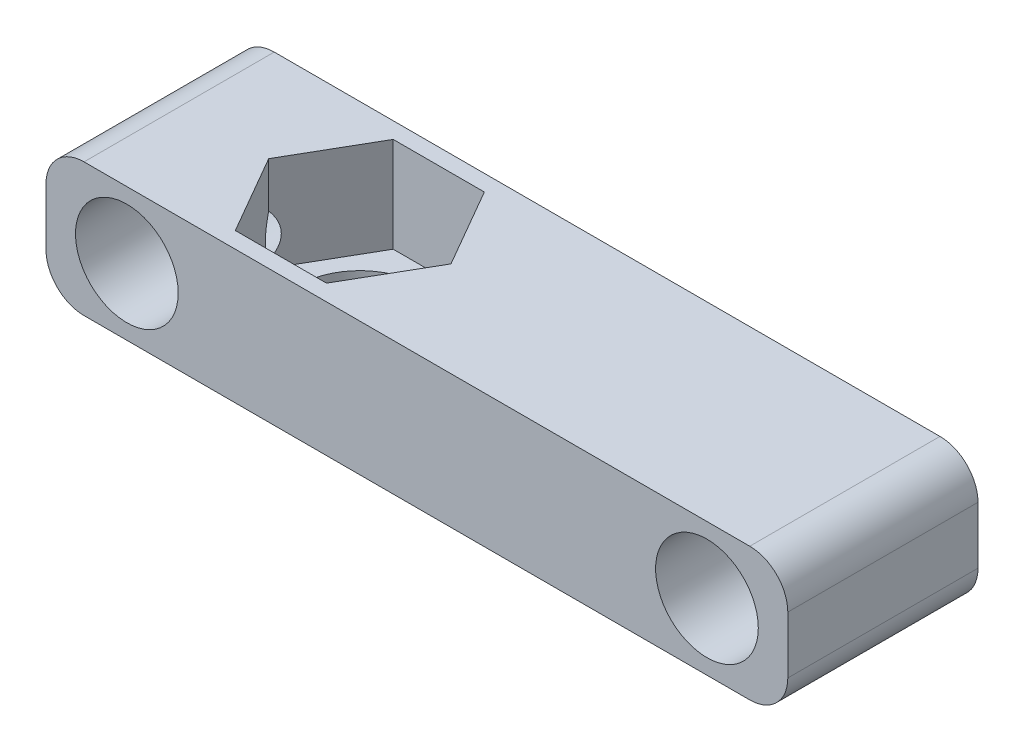
from build123d import *

# Parameters (mm, degrees)
CROQUIS1_W              = 39
CROQUIS1_H              = 7
CROQUIS1_R              = 2.7
SALIENTE_EXTRUIR1_DEPTH = 10
CORTAR_EXTRUIR1_DEPTH   = 7
REDONDEO1_R             = 2
CROQUIS4_R              = 3.25
SALIENTE_EXTRUIR2_DEPTH = 2


with BuildPart() as part:
    # Croquis1 → Saliente-Extruir1 (new body)
    with BuildSketch(Plane.XY):
        with Locations((-26.516694491, 12.37804878)):
            Rectangle(CROQUIS1_W, CROQUIS1_H)
        with Locations((-41.766694491, 12.37804878)):
            Circle(CROQUIS1_R, mode=Mode.SUBTRACT)
        with Locations((-11.266694491, 12.37804878)):
            Circle(CROQUIS1_R, mode=Mode.SUBTRACT)
    extrude(amount=SALIENTE_EXTRUIR1_DEPTH)

    # Croquis2 → Cortar-Extruir1 (cut)
    with BuildSketch(Plane.XZ.offset(-8.87804878)):
        Polygon((-29.724687257, 5), (-32.120690874, 9.15), (-36.912698108, 9.15), (-39.308701725, 5), (-36.912698108, 0.85), (-32.120690874, 0.85), align=None)
    extrude(amount=-CORTAR_EXTRUIR1_DEPTH, mode=Mode.SUBTRACT)

    # Redondeo1
    redondeo1_edges = [part.edges().sort_by_distance(p)[0] for p in [
        (-46.016694491, 15.87804878, 5),
        (-7.016694491, 15.87804878, 5),
        (-7.016694491, 8.87804878, 5),
        (-46.016694491, 8.87804878, 5),
    ]]
    fillet(redondeo1_edges, radius=REDONDEO1_R)

    # Croquis4 → Saliente-Extruir2 (add)
    with BuildSketch(Plane.XZ.offset(-8.87804878)):
        Polygon((-29.724687257, 5), (-32.120690874, 9.15), (-36.912698108, 9.15), (-39.308701725, 5), (-36.912698108, 0.85), (-32.120690874, 0.85), align=None)
        with Locations(Location((-34.516694491, 5, 0), (0, 0, 270))):
            Circle(CROQUIS4_R, mode=Mode.SUBTRACT)
    extrude(amount=-SALIENTE_EXTRUIR2_DEPTH)


solid = part.part
